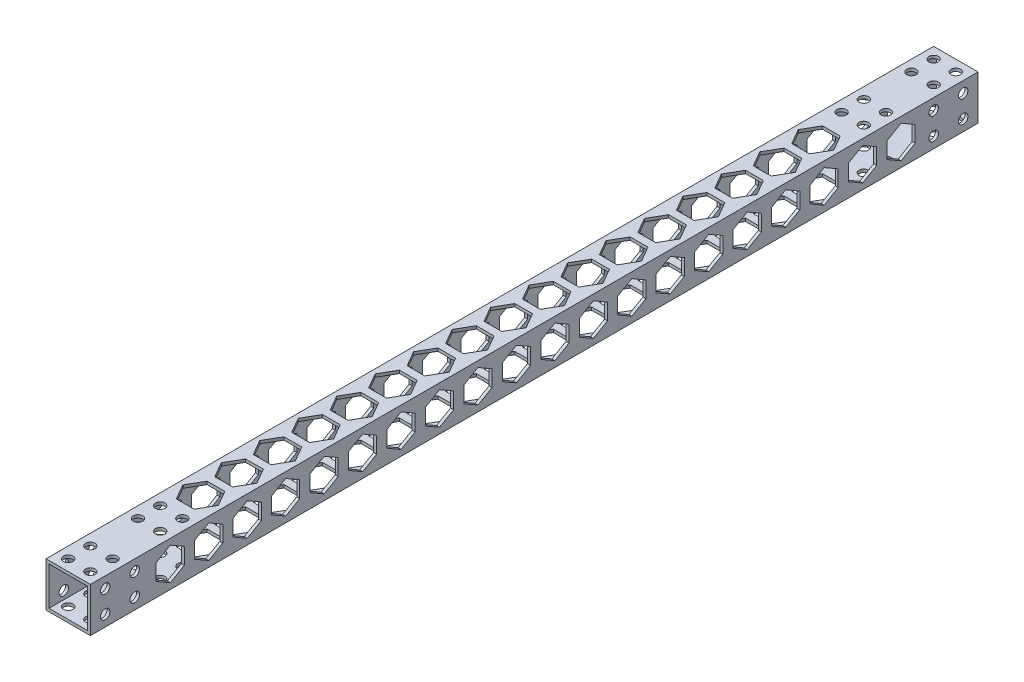
from build123d import *

# Parameters (mm, degrees)
SKETCH_1_W          = 15
SKETCH_1_H          = 15
SKETCH_1_W_2        = 13
SKETCH_1_H_2        = 13
EXTRUDE_1_DEPTH     = 300
SKETCH_2_R          = 1.6
CUT_EXTRUDE_1_DEPTH = 301.749064836
SKETCH_3_R          = 1.6
CUT_EXTRUDE_2_DEPTH = 301.749064836


with BuildPart() as part:
    # 草图1 → 拉伸-薄壁1 (new body)
    with BuildSketch(Plane.XY):
        with Locations((7.5, -7.5)):
            Rectangle(SKETCH_1_W, SKETCH_1_H)
        with Locations((7.5, -7.5)):
            Rectangle(SKETCH_1_W_2, SKETCH_1_H_2, mode=Mode.SUBTRACT)
    extrude(amount=EXTRUDE_1_DEPTH)

    # 草图2 → 切除-拉伸1 (cut, through all)
    with BuildSketch(Plane(origin=(15, 0, 0), x_dir=(0, 0, -1), z_dir=(1, 0, 0))):
        with Locations((-295, -3.75)):
            Circle(SKETCH_2_R)
        with Locations((-295, -11.25)):
            Circle(SKETCH_2_R)
        with Locations((-285, -11.25)):
            Circle(SKETCH_2_R)
        with Locations((-285, -3.75)):
            Circle(SKETCH_2_R)
        with Locations((-5, -3.75)):
            Circle(SKETCH_2_R)
        with Locations((-5, -11.25)):
            Circle(SKETCH_2_R)
        with Locations((-15, -11.25)):
            Circle(SKETCH_2_R)
        with Locations((-15, -3.75)):
            Circle(SKETCH_2_R)
        Polygon((-260, -2), (-264.763139721, -4.75), (-264.763139721, -10.25), (-260, -13), (-255.236860279, -10.25), (-255.236860279, -4.75), align=None)
        Polygon((-273, -2), (-277.763139721, -4.75), (-277.763139721, -10.25), (-273, -13), (-268.236860279, -10.25), (-268.236860279, -4.75), align=None)
        Polygon((-247, -2), (-251.763139721, -4.75), (-251.763139721, -10.25), (-247, -13), (-242.236860279, -10.25), (-242.236860279, -4.75), align=None)
        Polygon((-234, -2), (-238.763139721, -4.75), (-238.763139721, -10.25), (-234, -13), (-229.236860279, -10.25), (-229.236860279, -4.75), align=None)
        Polygon((-221, -2), (-225.763139721, -4.75), (-225.763139721, -10.25), (-221, -13), (-216.236860279, -10.25), (-216.236860279, -4.75), align=None)
        Polygon((-208, -2), (-212.763139721, -4.75), (-212.763139721, -10.25), (-208, -13), (-203.236860279, -10.25), (-203.236860279, -4.75), align=None)
        Polygon((-195, -2), (-199.763139721, -4.75), (-199.763139721, -10.25), (-195, -13), (-190.236860279, -10.25), (-190.236860279, -4.75), align=None)
        Polygon((-182, -2), (-186.763139721, -4.75), (-186.763139721, -10.25), (-182, -13), (-177.236860279, -10.25), (-177.236860279, -4.75), align=None)
        Polygon((-169, -2), (-173.763139721, -4.75), (-173.763139721, -10.25), (-169, -13), (-164.236860279, -10.25), (-164.236860279, -4.75), align=None)
        Polygon((-156, -2), (-160.763139721, -4.75), (-160.763139721, -10.25), (-156, -13), (-151.236860279, -10.25), (-151.236860279, -4.75), align=None)
        Polygon((-143, -2), (-147.763139721, -4.75), (-147.763139721, -10.25), (-143, -13), (-138.236860279, -10.25), (-138.236860279, -4.75), align=None)
        Polygon((-130, -2), (-134.763139721, -4.75), (-134.763139721, -10.25), (-130, -13), (-125.236860279, -10.25), (-125.236860279, -4.75), align=None)
        Polygon((-117, -2), (-121.763139721, -4.75), (-121.763139721, -10.25), (-117, -13), (-112.236860279, -10.25), (-112.236860279, -4.75), align=None)
        Polygon((-104, -2), (-108.763139721, -4.75), (-108.763139721, -10.25), (-104, -13), (-99.236860279, -10.25), (-99.236860279, -4.75), align=None)
        Polygon((-91, -2), (-95.763139721, -4.75), (-95.763139721, -10.25), (-91, -13), (-86.236860279, -10.25), (-86.236860279, -4.75), align=None)
        Polygon((-78, -2), (-82.763139721, -4.75), (-82.763139721, -10.25), (-78, -13), (-73.236860279, -10.25), (-73.236860279, -4.75), align=None)
        Polygon((-65, -2), (-69.763139721, -4.75), (-69.763139721, -10.25), (-65, -13), (-60.236860279, -10.25), (-60.236860279, -4.75), align=None)
        Polygon((-52, -2), (-56.763139721, -4.75), (-56.763139721, -10.25), (-52, -13), (-47.236860279, -10.25), (-47.236860279, -4.75), align=None)
        Polygon((-39, -2), (-43.763139721, -4.75), (-43.763139721, -10.25), (-39, -13), (-34.236860279, -10.25), (-34.236860279, -4.75), align=None)
        Polygon((-26, -2), (-30.763139721, -4.75), (-30.763139721, -10.25), (-26, -13), (-21.236860279, -10.25), (-21.236860279, -4.75), align=None)
    extrude(amount=-CUT_EXTRUDE_1_DEPTH, mode=Mode.SUBTRACT)

    # 草图3 → 切除-拉伸2 (cut, through all)
    with BuildSketch(Plane(origin=(0, 0, 0), x_dir=(1, 0, 0), z_dir=(0, 1, 0))):
        with Locations(Location((3.75, -3.75, 0), (0, 0, 270))):
            Circle(SKETCH_3_R)
        with Locations(Location((11.25, -3.75, 0), (0, 0, 90))):
            Circle(SKETCH_3_R)
        with Locations(Location((11.25, -11.25, 0), (0, 0, 270))):
            Circle(SKETCH_3_R)
        with Locations(Location((3.75, -11.25, 0), (0, 0, 90))):
            Circle(SKETCH_3_R)
        with Locations(Location((3.75, -288.75, 0), (0, 0, 270))):
            Circle(SKETCH_3_R)
        with Locations(Location((11.25, -288.75, 0), (0, 0, 90))):
            Circle(SKETCH_3_R)
        with Locations(Location((11.25, -296.25, 0), (0, 0, 270))):
            Circle(SKETCH_3_R)
        with Locations(Location((3.75, -296.25, 0), (0, 0, 90))):
            Circle(SKETCH_3_R)
        with Locations(Location((3.75, -27.35, 0), (0, 0, 270))):
            Circle(SKETCH_3_R)
        with Locations(Location((11.25, -27.35, 0), (0, 0, 90))):
            Circle(SKETCH_3_R)
        with Locations(Location((11.25, -34.85, 0), (0, 0, 270))):
            Circle(SKETCH_3_R)
        with Locations(Location((3.75, -34.85, 0), (0, 0, 90))):
            Circle(SKETCH_3_R)
        with Locations(Location((3.75, -265.15, 0), (0, 0, 270))):
            Circle(SKETCH_3_R)
        with Locations(Location((11.25, -265.15, 0), (0, 0, 90))):
            Circle(SKETCH_3_R)
        with Locations(Location((11.25, -272.65, 0), (0, 0, 270))):
            Circle(SKETCH_3_R)
        with Locations(Location((3.75, -272.65, 0), (0, 0, 90))):
            Circle(SKETCH_3_R)
        Polygon((10.5, -55.053847577), (4.5, -55.053847577), (1.5, -60.25), (4.5, -65.446152423), (10.5, -65.446152423), (13.5, -60.25), align=None)
        Polygon((4.5, -42.053847577), (1.5, -47.25), (4.5, -52.446152423), (10.5, -52.446152423), (13.5, -47.25), (10.5, -42.053847577), align=None)
        Polygon((10.5, -68.053847577), (4.5, -68.053847577), (1.5, -73.25), (4.5, -78.446152423), (10.5, -78.446152423), (13.5, -73.25), align=None)
        Polygon((10.5, -81.053847577), (4.5, -81.053847577), (1.5, -86.25), (4.5, -91.446152423), (10.5, -91.446152423), (13.5, -86.25), align=None)
        Polygon((10.5, -94.053847577), (4.5, -94.053847577), (1.5, -99.25), (4.5, -104.446152423), (10.5, -104.446152423), (13.5, -99.25), align=None)
        Polygon((10.5, -107.053847577), (4.5, -107.053847577), (1.5, -112.25), (4.5, -117.446152423), (10.5, -117.446152423), (13.5, -112.25), align=None)
        Polygon((10.5, -120.053847577), (4.5, -120.053847577), (1.5, -125.25), (4.5, -130.446152423), (10.5, -130.446152423), (13.5, -125.25), align=None)
        Polygon((10.5, -133.053847577), (4.5, -133.053847577), (1.5, -138.25), (4.5, -143.446152423), (10.5, -143.446152423), (13.5, -138.25), align=None)
        Polygon((10.5, -146.053847577), (4.5, -146.053847577), (1.5, -151.25), (4.5, -156.446152423), (10.5, -156.446152423), (13.5, -151.25), align=None)
        Polygon((10.5, -159.053847577), (4.5, -159.053847577), (1.5, -164.25), (4.5, -169.446152423), (10.5, -169.446152423), (13.5, -164.25), align=None)
        Polygon((10.5, -172.053847577), (4.5, -172.053847577), (1.5, -177.25), (4.5, -182.446152423), (10.5, -182.446152423), (13.5, -177.25), align=None)
        Polygon((10.5, -185.053847577), (4.5, -185.053847577), (1.5, -190.25), (4.5, -195.446152423), (10.5, -195.446152423), (13.5, -190.25), align=None)
        Polygon((10.5, -198.053847577), (4.5, -198.053847577), (1.5, -203.25), (4.5, -208.446152423), (10.5, -208.446152423), (13.5, -203.25), align=None)
        Polygon((10.5, -211.053847577), (4.5, -211.053847577), (1.5, -216.25), (4.5, -221.446152423), (10.5, -221.446152423), (13.5, -216.25), align=None)
        Polygon((10.5, -224.053847577), (4.5, -224.053847577), (1.5, -229.25), (4.5, -234.446152423), (10.5, -234.446152423), (13.5, -229.25), align=None)
        Polygon((10.5, -237.053847577), (4.5, -237.053847577), (1.5, -242.25), (4.5, -247.446152423), (10.5, -247.446152423), (13.5, -242.25), align=None)
        Polygon((10.5, -250.053847577), (4.5, -250.053847577), (1.5, -255.25), (4.5, -260.446152423), (10.5, -260.446152423), (13.5, -255.25), align=None)
    extrude(amount=-CUT_EXTRUDE_2_DEPTH, mode=Mode.SUBTRACT)


solid = part.part
